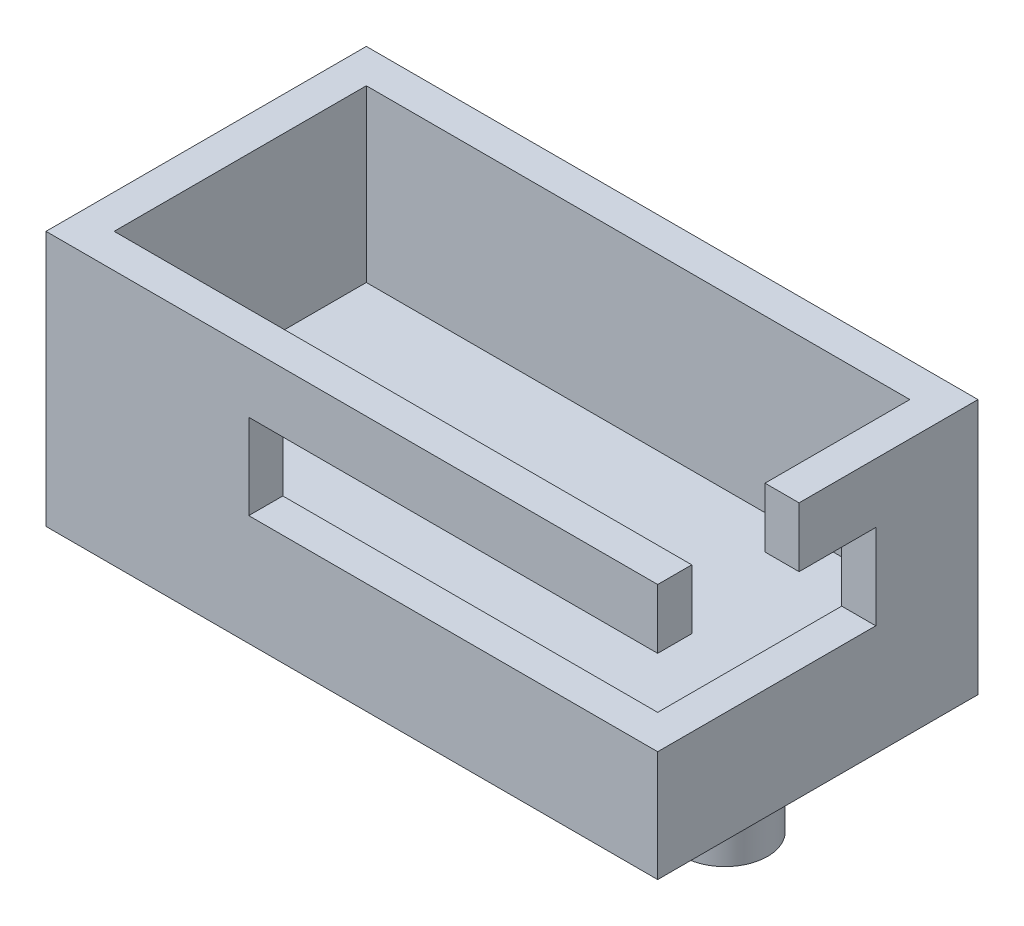
from build123d import *

# Parameters (mm, degrees)
SKETCH1_W           = 35.9
SKETCH1_H           = 18.8
SKETCH1_W_2         = 31.9
SKETCH1_H_2         = 14.8
BOSS_EXTRUDE1_DEPTH = 10
SKETCH1_2_W         = 35.9
SKETCH1_2_H         = 18.8
SKETCH1_2_W_2       = 31.9
SKETCH1_2_H_2       = 14.8
BOSS_EXTRUDE2_DEPTH = 5
SKETCH2_W           = 24
SKETCH2_H           = 5
CUT_EXTRUDE1_DEPTH  = 12.8
SKETCH3_W           = 6.3
SKETCH3_H           = 3.5
CUT_EXTRUDE2_DEPTH  = 2
SKETCH4_R           = 2.5
BOSS_EXTRUDE3_DEPTH = 5
FILLET1_R           = 0.4


with BuildPart() as part:
    # Sketch1 → Boss-Extrude1 (new body)
    with BuildSketch(Plane(origin=(0, 0, 0), x_dir=(1, 0, 0), z_dir=(0, 1, 0))):
        with Locations((15.95, 7.4)):
            Rectangle(SKETCH1_W, SKETCH1_H)
        with Locations((15.95, 7.4)):
            Rectangle(SKETCH1_W_2, SKETCH1_H_2, mode=Mode.SUBTRACT)
    extrude(amount=BOSS_EXTRUDE1_DEPTH)

    # Sketch1<2> → Boss-Extrude2 (add)
    # profile 1 of 2: a face of its own
    with BuildSketch(Plane(origin=(0, 0, 0), x_dir=(1, 0, 0), z_dir=(0, 1, 0))):
        with Locations((15.95, 7.4)):
            Rectangle(SKETCH1_2_W, SKETCH1_2_H)
        with Locations((15.95, 7.4)):
            Rectangle(SKETCH1_2_W_2, SKETCH1_2_H_2, mode=Mode.SUBTRACT)
    # profile 2 of 2: a face of its own
    with BuildSketch(Plane(origin=(0, 0, 0), x_dir=(1, 0, 0), z_dir=(0, 1, 0))):
        with Locations((15.95, 7.4)):
            Rectangle(SKETCH1_2_W_2, SKETCH1_2_H_2)
    extrude(amount=-BOSS_EXTRUDE2_DEPTH)

    # Sketch2 → Cut-Extrude1 (cut)
    with BuildSketch(Plane.XY.offset(2)):
        with Locations((21.9, 4)):
            Rectangle(SKETCH2_W, SKETCH2_H)
    extrude(amount=-CUT_EXTRUDE1_DEPTH, mode=Mode.SUBTRACT)

    # Sketch3 → Cut-Extrude2 (cut)
    with BuildSketch(Plane(origin=(33.9, 0, 0), x_dir=(0, 0, -1), z_dir=(1, 0, 0))):
        with Locations((3.15, 8.25)):
            Rectangle(SKETCH3_W, SKETCH3_H)
    extrude(amount=-CUT_EXTRUDE2_DEPTH, mode=Mode.SUBTRACT)

    # Sketch4 → Boss-Extrude3 (add)
    with BuildSketch(Plane.XZ.offset(5)):
        with Locations(Location((3.45, -7.4, 0), (0, 0, 90))):
            Circle(SKETCH4_R)
        with Locations(Location((28.45, -7.4, 0), (0, 0, 90))):
            Circle(SKETCH4_R)
    extrude(amount=BOSS_EXTRUDE3_DEPTH)

    # Fillet1
    fillet1_edges = [part.edges().sort_by_distance(p)[0] for p in [
        (3.45, -5, -9.9),
        (28.45, -5, -9.9),
    ]]
    fillet(fillet1_edges, radius=FILLET1_R)


solid = part.part
